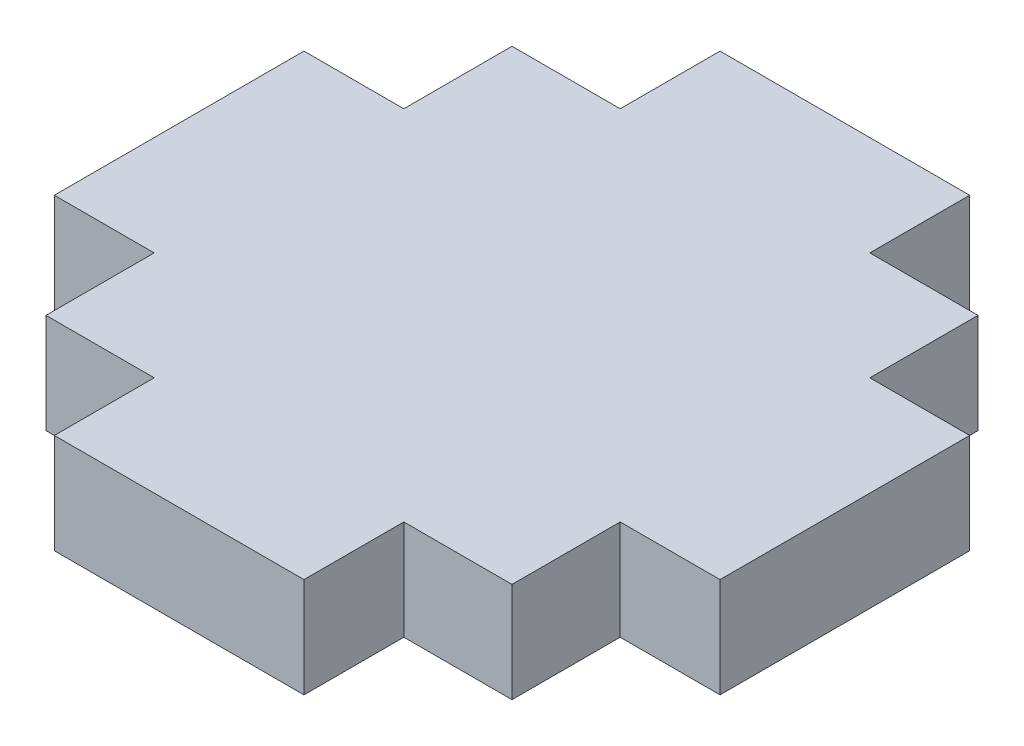
from build123d import *

# Parameters (mm, degrees)
SALIENTE_EXTRUIR1_DEPTH = 6


with BuildPart() as part:
    # Croquis1 → Saliente-Extruir1 (new body)
    with BuildSketch(Plane(origin=(0, 0, 0), x_dir=(1, 0, 0), z_dir=(0, 1, 0))):
        Polygon((27.5, 40), (12.5, 40), (12.5, 34), (6, 34), (6, 27.5), (0, 27.5), (0, 12.5), (6, 12.5), (6, 6), (12.5, 6), (12.5, 0), (27.5, 0), (27.5, 6), (34, 6), (34, 12.5), (40, 12.5), (40, 27.5), (34, 27.5), (34, 34), (27.5, 34), align=None)
    extrude(amount=SALIENTE_EXTRUIR1_DEPTH)


solid = part.part
